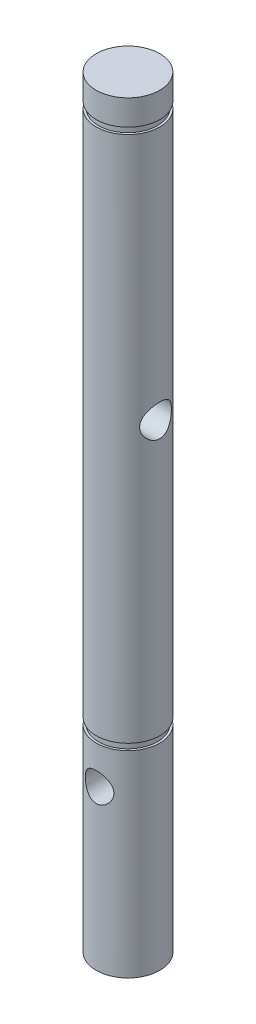
from build123d import *

# Parameters (mm, degrees)
SKETCH1_R               = 5
BOSS_EXTRUDE1_DEPTH     = 60
CUT_EXTRUDE2_DEPTH      = 61.415229868
CUT_EXTRUDE2_DEPTH_BACK = 61.415229868
SKETCH3_R               = 2.25
SKETCH4_R               = 5
SKETCH4_R_2             = 4.65
CUT_EXTRUDE3_DEPTH      = 1
CUT_EXTRUDE4_START      = 1
SKETCH5_R               = 5
SKETCH5_R_2             = 4.65
CUT_EXTRUDE4_DEPTH      = 1
CUT_EXTRUDE5_DEPTH      = 61.415229984
CUT_EXTRUDE5_DEPTH_BACK = 61.415229984
SKETCH6_R               = 2.5


with BuildPart() as part:
    # Sketch1 → Boss-Extrude1 (new, symmetric)
    with BuildSketch(Plane(origin=(0, 0, 0), x_dir=(1, 0, 0), z_dir=(0, 1, 0))):
        with Locations(Location((0, 0, 0), (0, 0, 270))):
            Circle(SKETCH1_R)
    extrude(amount=BOSS_EXTRUDE1_DEPTH, both=True)

    # Sketch3 → Cut-Extrude2 (cut, two sides: drawn at the far end of the back side and taken through both)
    with BuildSketch(Plane.XY.offset(-CUT_EXTRUDE2_DEPTH_BACK)):
        with Locations(Location((0, -35, 0), (0, 0, 89.999999993))):
            Circle(SKETCH3_R)
    extrude(amount=CUT_EXTRUDE2_DEPTH + CUT_EXTRUDE2_DEPTH_BACK, mode=Mode.SUBTRACT)

    # Sketch4 → Cut-Extrude3 (cut)
    with BuildSketch(Plane(origin=(0, -28, 0), x_dir=(-1, 0, 0), z_dir=(0, -1, 0))):
        with Locations(Location((0, 0, 0), (0, 0, 90))):
            Circle(SKETCH4_R)
        with Locations(Location((0, 0, 0), (0, 0, 90))):
            Circle(SKETCH4_R_2, mode=Mode.SUBTRACT)
    extrude(amount=CUT_EXTRUDE3_DEPTH, mode=Mode.SUBTRACT)

    # Sketch5 → Cut-Extrude4 (cut)
    with BuildSketch(Plane(origin=(0, 55, 0), x_dir=(1, 0, 0), z_dir=(0, 1, 0)).offset(CUT_EXTRUDE4_START)):
        with Locations(Location((0, 0, 0), (0, 0, 90))):
            Circle(SKETCH5_R)
        with Locations(Location((0, 0, 0), (0, 0, 90))):
            Circle(SKETCH5_R_2, mode=Mode.SUBTRACT)
    extrude(amount=-CUT_EXTRUDE4_DEPTH, mode=Mode.SUBTRACT)

    # Sketch6 → Cut-Extrude5 (cut, two sides: drawn at the far end of the back side and taken through both)
    with BuildSketch(Plane(origin=(0, 0, 0), x_dir=(0, 0, -1), z_dir=(1, 0, 0)).offset(-CUT_EXTRUDE5_DEPTH_BACK)):
        with Locations((0, 15)):
            Circle(SKETCH6_R)
    extrude(amount=CUT_EXTRUDE5_DEPTH + CUT_EXTRUDE5_DEPTH_BACK, mode=Mode.SUBTRACT)


solid = part.part
